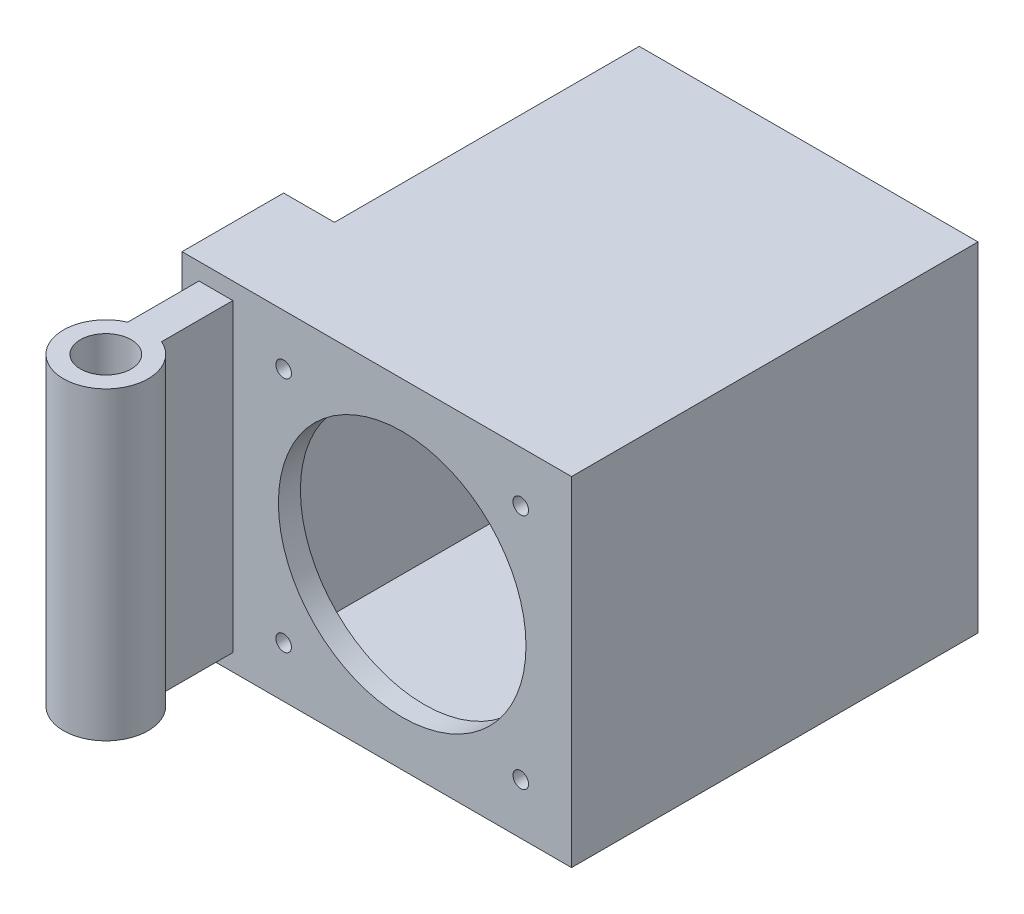
from build123d import *

# Parameters (mm, degrees)
SKETCH1_W                           = 100
SKETCH1_H                           = 100
BOSS_EXTRUDE1_DEPTH                 = 60
SKETCH2_W                           = 87
SKETCH2_H                           = 87
CUT_EXTRUDE1_DEPTH                  = 113.5
SKETCH4_R                           = 36.55
CUT_EXTRUDE2_DEPTH                  = 6.5
F_4_6_4_6_DIAMETER_HOLE1_D          = 4.6
CIRPATTERN1_COUNT                   = 4
SKETCH13_W                          = 30
SKETCH13_H                          = 100
BOSS_EXTRUDE6_DEPTH                 = 15
BOSS_EXTRUDE7_DEPTH                 = 45
BOSS_EXTRUDE7_DEPTH_BACK            = 45
SKETCH15_R                          = 12.5
BOSS_EXTRUDE8_REACH                 = 148.48
BOSS_EXTRUDE8_END_RADIUS            = 12.5
SKETCH14_W                          = 10
SKETCH14_H                          = 90
SKETCH16_R                          = 7.5
CUT_EXTRUDE4_DEPTH                  = 90
CUT_EXTRUDE5_REACH                  = 165.554
CUT_EXTRUDE5_END_RADIUS             = 12.5
SKETCH17_R                          = 2.25
CUT_EXTRUDE5_DIRECTION_2_REACH      = 165.554
CUT_EXTRUDE5_DIRECTION_2_END_RADIUS = 7.5


with BuildPart() as part:
    # Sketch1 → Boss-Extrude1 (new, symmetric)
    with BuildSketch(Plane.XY):
        Rectangle(SKETCH1_W, SKETCH1_H)
    extrude(amount=BOSS_EXTRUDE1_DEPTH, both=True)

    # Sketch2 → Cut-Extrude1 (cut)
    with BuildSketch(Plane(origin=(0, 0, -60), x_dir=(-1, 0, 0), z_dir=(0, 0, -1))):
        Rectangle(SKETCH2_W, SKETCH2_H)
    extrude(amount=-CUT_EXTRUDE1_DEPTH, mode=Mode.SUBTRACT)

    # Sketch4 → Cut-Extrude2 (cut)
    with BuildSketch(Plane.XY.offset(60)):
        Circle(SKETCH4_R)
    extrude(amount=-CUT_EXTRUDE2_DEPTH, mode=Mode.SUBTRACT)

    # Ø4.6 (4.6) Diameter Hole1 (through all)
    with Locations(Plane.XY.offset(60)):
        with Locations((-35, 35)):
            f_4_6_4_6_diameter_hole1 = Hole(F_4_6_4_6_DIAMETER_HOLE1_D / 2)

    # CirPattern1: Ø4.6 (4.6) Diameter Hole1 ×4 about axis
    cirpattern1_axis = Axis((0, 0, 0), (0, 0, 1))
    for i in range(1, CIRPATTERN1_COUNT):
        add(f_4_6_4_6_diameter_hole1.rotate(cirpattern1_axis, i * 360 / CIRPATTERN1_COUNT), mode=Mode.SUBTRACT)

    # Sketch13 → Boss-Extrude6 (add)
    with BuildSketch(Plane.ZY.offset(50)):
        with Locations((45, 0)):
            Rectangle(SKETCH13_W, SKETCH13_H)
    extrude(amount=BOSS_EXTRUDE6_DEPTH)



with BuildPart() as body_2:
    # Sketch15 → Boss-Extrude7 (new, two sides: drawn at the far end of the back side and taken through both)
    with BuildSketch(Plane(origin=(0, 0, 0), x_dir=(1, 0, 0), z_dir=(0, 1, 0)).offset(-BOSS_EXTRUDE7_DEPTH_BACK)):
        with Locations(Location((-55, -92.5, 0), (0, 0, 270))):
            Circle(SKETCH15_R)
    extrude(amount=BOSS_EXTRUDE7_DEPTH + BOSS_EXTRUDE7_DEPTH_BACK)


with BuildPart() as part_1:
    add(part.part)

    add(body_2.part)  # Boss-Extrude8 merges body 2
    # Boss-Extrude8: up to this cylinder (the profile starts outside it)
    boss_extrude8_end = Plane(origin=(-55, 0, 92.5), z_dir=(0, -1, 0)) * Cylinder(BOSS_EXTRUDE8_END_RADIUS, 322.96, mode=Mode.PRIVATE)
    # Sketch14 → Boss-Extrude8 (add, up to the surface)
    with BuildSketch(Plane.XY.offset(60), mode=Mode.PRIVATE) as boss_extrude8_sk1:
        with Locations((-55, 0)):
            Rectangle(SKETCH14_W, SKETCH14_H)
    boss_extrude8_tool1 = extrude(boss_extrude8_sk1.sketch, amount=BOSS_EXTRUDE8_REACH, mode=Mode.PRIVATE) - boss_extrude8_end
    add(boss_extrude8_tool1.solids().sort_by_distance((-55, 0, 60))[0])

    # Sketch16 → Cut-Extrude4 (cut)
    with BuildSketch(Plane(origin=(0, 45, 0), x_dir=(1, 0, 0), z_dir=(0, 1, 0))):
        with Locations(Location((-55, -92.5, 0), (0, 0, 270))):
            Circle(SKETCH16_R)
    extrude(amount=-CUT_EXTRUDE4_DEPTH, mode=Mode.SUBTRACT)

    # Cut-Extrude5: up to this cylinder (the profile starts inside it)
    cut_extrude5_end = Plane(origin=(-55, 0, 92.5), z_dir=(0, -1, 0)) * Cylinder(CUT_EXTRUDE5_END_RADIUS, 357.108, mode=Mode.PRIVATE)
    # Sketch17 → Cut-Extrude5 (cut, up to the surface)
    with BuildSketch(Plane(origin=(-65, 0, 0), x_dir=(0, 0, -1), z_dir=(1, 0, 0)), mode=Mode.PRIVATE) as cut_extrude5_sk1:
        with Locations((-92.5, 0)):
            Circle(SKETCH17_R)
    cut_extrude5_tool1 = extrude(cut_extrude5_sk1.sketch, amount=-CUT_EXTRUDE5_REACH, mode=Mode.PRIVATE) & cut_extrude5_end
    add(cut_extrude5_tool1.solids().sort_by_distance((-65, 0, 92.5))[0], mode=Mode.SUBTRACT)

    # Cut-Extrude5 direction 2: up to this cylinder (the profile starts outside it)
    cut_extrude5_direction_2_end = Plane(origin=(-55, 0, 92.5), z_dir=(0, 1, 0)) * Cylinder(CUT_EXTRUDE5_DIRECTION_2_END_RADIUS, 347.108, mode=Mode.PRIVATE)
    # Sketch17 → Cut-Extrude5 direction 2 (cut, up to the surface)
    with BuildSketch(Plane(origin=(-65, 0, 0), x_dir=(0, 0, -1), z_dir=(1, 0, 0)), mode=Mode.PRIVATE) as cut_extrude5_direction_2_sk1:
        with Locations((-92.5, 0)):
            Circle(SKETCH17_R)
    cut_extrude5_direction_2_tool1 = extrude(cut_extrude5_direction_2_sk1.sketch, amount=CUT_EXTRUDE5_DIRECTION_2_REACH, mode=Mode.PRIVATE) - cut_extrude5_direction_2_end
    add(cut_extrude5_direction_2_tool1.solids().sort_by_distance((-65, 0, 92.5))[0], mode=Mode.SUBTRACT)


solid = part_1.part
